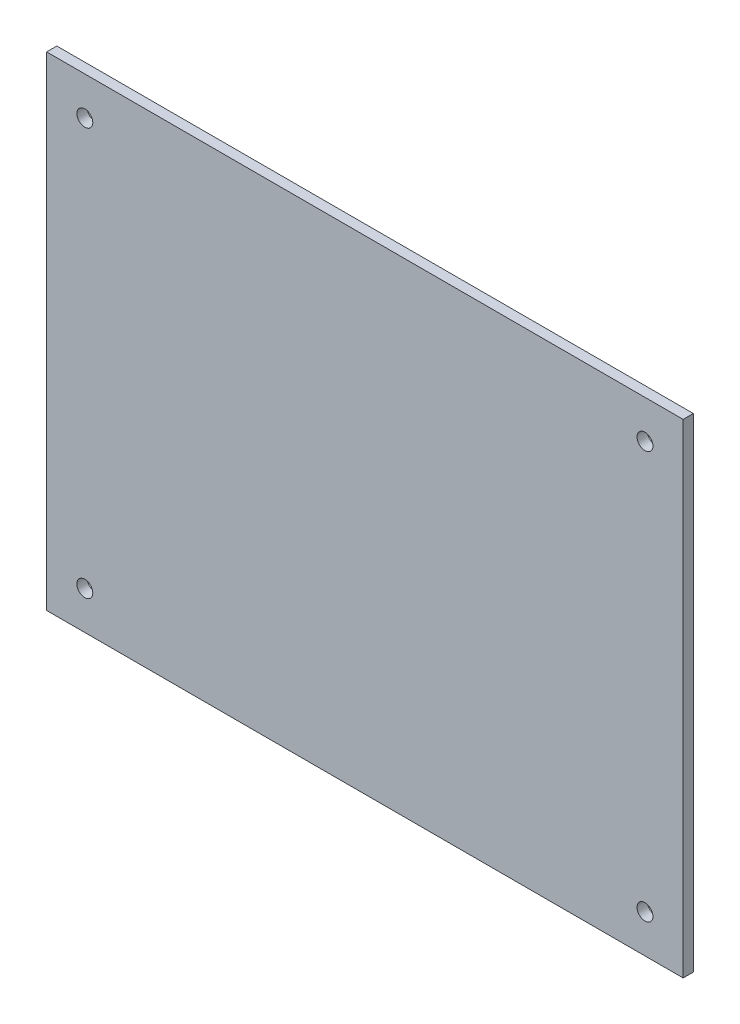
from build123d import *

# Parameters (mm, degrees)
SKETCH1_W           = 100
SKETCH1_H           = 76
SKETCH1_R           = 1.25
BOSS_EXTRUDE1_DEPTH = 1.6


with BuildPart() as part:
    # Sketch1 → Boss-Extrude1 (new body)
    with BuildSketch(Plane.XY):
        Rectangle(SKETCH1_W, SKETCH1_H)
        with Locations((-44, 32)):
            Circle(SKETCH1_R, mode=Mode.SUBTRACT)
        with Locations((44, 32)):
            Circle(SKETCH1_R, mode=Mode.SUBTRACT)
        with Locations((44, -32)):
            Circle(SKETCH1_R, mode=Mode.SUBTRACT)
        with Locations((-44, -32)):
            Circle(SKETCH1_R, mode=Mode.SUBTRACT)
    extrude(amount=BOSS_EXTRUDE1_DEPTH)


solid = part.part
